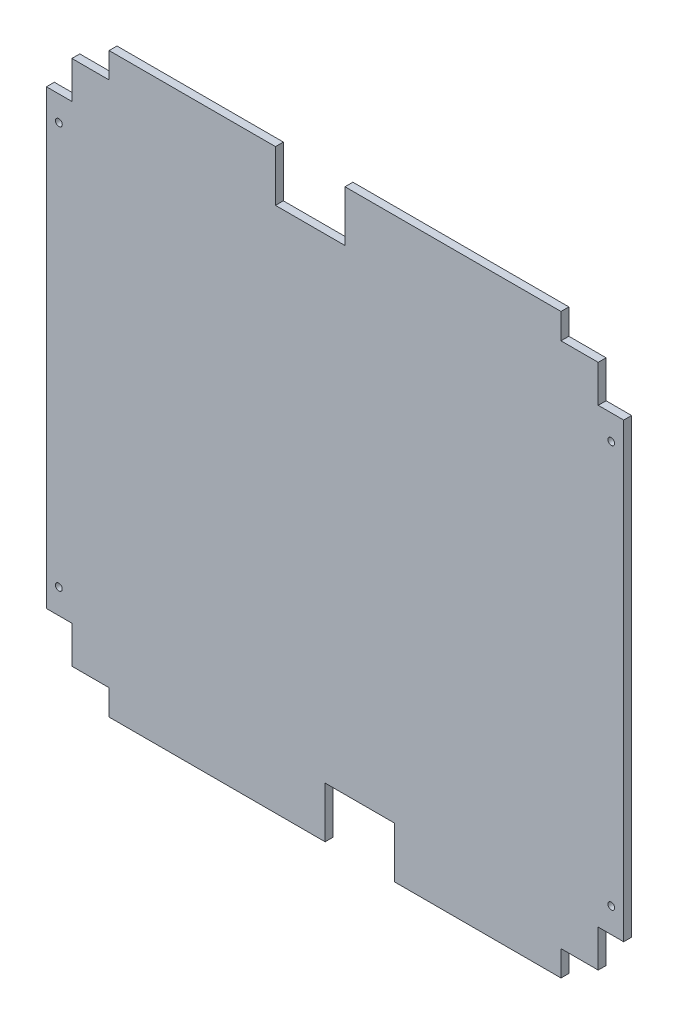
from build123d import *

# Parameters (mm, degrees)
SKETCH1_R           = 2.75
BOSS_EXTRUDE1_DEPTH = 6.35


with BuildPart() as part:
    # Sketch1 → Boss-Extrude1 (new body)
    with BuildSketch(Plane.XY):
        Polygon((182, -212), (212, -212), (212, -182), (232.5, -182), (232.5, 0), (232.5, 182), (212, 182), (212, 212), (182, 212), (182, 232.5), (8, 232.5), (8, 191.5), (-48, 191.5), (-48, 232.5), (-182, 232.5), (-182, 212), (-212, 212), (-212, 182), (-232.5, 182), (-232.5, 0), (-232.5, -182), (-212, -182), (-212, -212), (-182, -212), (-182, -232.5), (-8, -232.5), (-8, -191.5), (48, -191.5), (48, -232.5), (182, -232.5), align=None)
        with Locations((-222.5, -162)):
            Circle(SKETCH1_R, mode=Mode.SUBTRACT)
        with Locations(Location((222.5, -162, 0), (0, 0, 180))):
            Circle(SKETCH1_R, mode=Mode.SUBTRACT)
        with Locations((222.5, 162)):
            Circle(SKETCH1_R, mode=Mode.SUBTRACT)
        with Locations(Location((-222.5, 162, 0), (0, 0, 180))):
            Circle(SKETCH1_R, mode=Mode.SUBTRACT)
    extrude(amount=BOSS_EXTRUDE1_DEPTH)


solid = part.part
